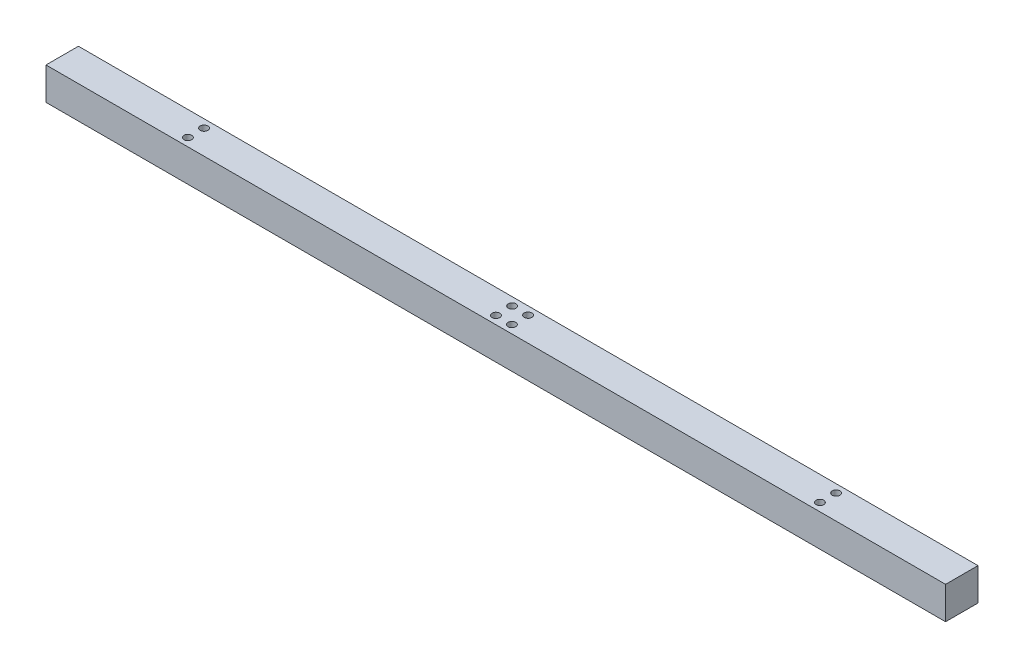
from build123d import *

# Parameters (mm, degrees)
SKETCH2_W                           = 10
SKETCH2_H                           = 10
BOSS_EXTRUDE1_DEPTH                 = 277.4
F_3_32_0_09375_DIAMETER_HOLE3_D     = 2.38125
F_3_32_0_09375_DIAMETER_HOLE3_DEPTH = 5
F_3_32_0_09375_DIAMETER_HOLE3_TIP   = 0.715399675
F_3_32_0_09375_DIAMETER_HOLE5_D     = 2.38125
F_3_32_0_09375_DIAMETER_HOLE5_DEPTH = 5
F_3_32_0_09375_DIAMETER_HOLE5_TIP   = 0.715399675


with BuildPart() as part:
    # Sketch2 → Boss-Extrude1 (new body)
    with BuildSketch(Plane(origin=(0, 0, 0), x_dir=(0, 0, -1), z_dir=(1, 0, 0))):
        Rectangle(SKETCH2_W, SKETCH2_H)
    extrude(amount=BOSS_EXTRUDE1_DEPTH)

    # 3/32 (0.09375) Diameter Hole3
    with Locations(Plane(origin=(0, -5, 0), x_dir=(-1, 0, 0), z_dir=(0, -1, 0))):
        with Locations((-5.85, 0), (-271.55, 0)):
            Hole(F_3_32_0_09375_DIAMETER_HOLE3_D / 2, depth=F_3_32_0_09375_DIAMETER_HOLE3_DEPTH)
            with Locations((0, 0, -(F_3_32_0_09375_DIAMETER_HOLE3_DEPTH + F_3_32_0_09375_DIAMETER_HOLE3_TIP / 2))):  # 118° drill point
                Cone(0, F_3_32_0_09375_DIAMETER_HOLE3_D / 2, F_3_32_0_09375_DIAMETER_HOLE3_TIP, mode=Mode.SUBTRACT)

    # 3/32 (0.09375) Diameter Hole5
    with Locations(Plane(origin=(0, 5, 0), x_dir=(1, 0, 0), z_dir=(0, 1, 0))):
        with Locations((41.25, 2.5), (41.25, -2.5), (136.25, 2.5), (136.25, -2.5), (141.15, -2.5), (141.15, 2.5), (236.15, -2.5), (236.15, 2.5)):
            Hole(F_3_32_0_09375_DIAMETER_HOLE5_D / 2, depth=F_3_32_0_09375_DIAMETER_HOLE5_DEPTH)
            with Locations((0, 0, -(F_3_32_0_09375_DIAMETER_HOLE5_DEPTH + F_3_32_0_09375_DIAMETER_HOLE5_TIP / 2))):  # 118° drill point
                Cone(0, F_3_32_0_09375_DIAMETER_HOLE5_D / 2, F_3_32_0_09375_DIAMETER_HOLE5_TIP, mode=Mode.SUBTRACT)


solid = part.part
